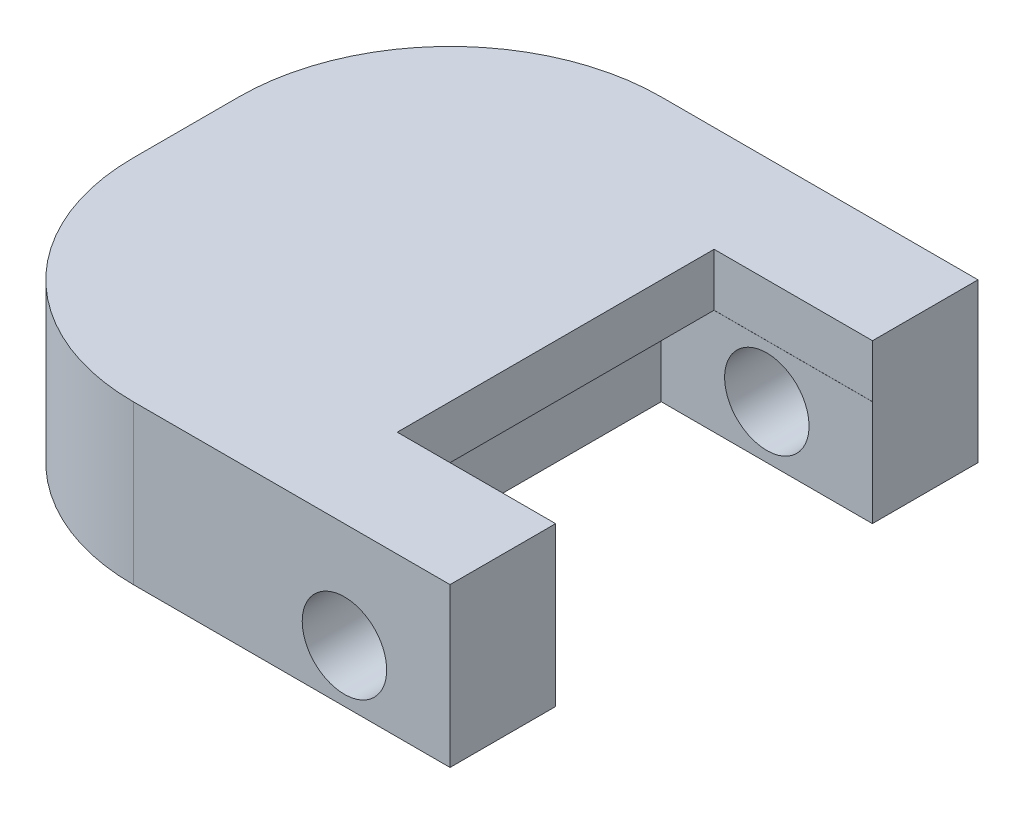
from build123d import *

# Parameters (mm, degrees)
BOSS_EXTRUDE1_DEPTH     = 38.1
SKETCH2_W               = 76.2
SKETCH2_H               = 50.8
CUT_EXTRUDE1_DEPTH      = 50.8
CUT_EXTRUDE2_DEPTH      = 126.723585695
CUT_EXTRUDE2_DEPTH_BACK = 126.723585695
SKETCH3_R               = 10.16
SKETCH6_W               = 76.223232364
SKETCH6_H               = 12.7
CUT_EXTRUDE4_DEPTH      = 38.1


with BuildPart() as part:
    # Sketch1 → Boss-Extrude1 (new body)
    with BuildSketch(Plane(origin=(0, 0, 0), x_dir=(1, 0, 0), z_dir=(0, 1, 0))):
        with BuildLine():
            Line((63.5, 63.5), (-12.7, 63.5))
            ThreePointArc((-12.7, 63.5), (-48.621024484, 48.621024484), (-63.5, 12.7))
            Line((-63.5, 12.7), (-63.5, -12.7))
            ThreePointArc((-63.5, -12.7), (-48.621024484, -48.621024484), (-12.7, -63.5))
            Line((-12.7, -63.5), (63.5, -63.5))
            Line((63.5, -63.5), (63.5, 63.5))
        make_face()
    extrude(amount=BOSS_EXTRUDE1_DEPTH)

    # Sketch2 → Cut-Extrude1 (cut)
    with BuildSketch(Plane(origin=(63.5, 0, 0), x_dir=(0, 0, -1), z_dir=(1, 0, 0))):
        Rectangle(SKETCH2_W, SKETCH2_H)
    extrude(amount=-CUT_EXTRUDE1_DEPTH, mode=Mode.SUBTRACT)

    # Sketch3 → Cut-Extrude2 (cut, two sides: drawn at the far end of the back side and taken through both)
    with BuildSketch(Plane(origin=(0, 0, 38.1), x_dir=(-1, 0, 0), z_dir=(0, 0, -1)).offset(-CUT_EXTRUDE2_DEPTH_BACK)):
        with Locations((-38.1, 12.7)):
            Circle(SKETCH3_R)
    extrude(amount=CUT_EXTRUDE2_DEPTH + CUT_EXTRUDE2_DEPTH_BACK, mode=Mode.SUBTRACT)

    # Sketch6 → Cut-Extrude4 (cut)
    with BuildSketch(Plane(origin=(63.5, 0, 0), x_dir=(0, 0, -1), z_dir=(1, 0, 0))):
        with Locations((0.011616182, 31.75)):
            Rectangle(SKETCH6_W, SKETCH6_H)
    extrude(amount=-CUT_EXTRUDE4_DEPTH, mode=Mode.SUBTRACT)


solid = part.part
